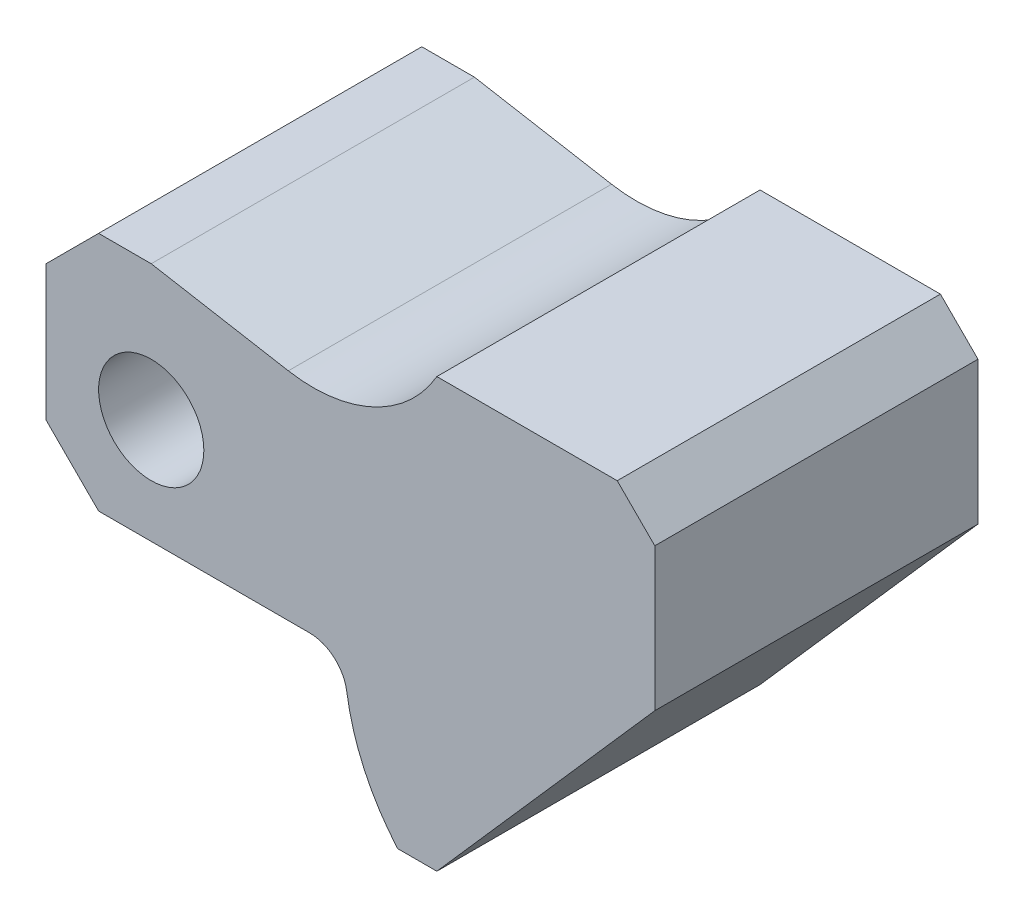
from build123d import *

# Parameters (mm, degrees)
SKETCH1_R           = 7
BOSS_EXTRUDE1_DEPTH = 43


with BuildPart() as part:
    # Sketch1 → Boss-Extrude1 (new body)
    with BuildSketch(Plane.XY):
        with BuildLine():
            Line((0, 7), (0, 25))
            Line((0, 25), (7, 32))
            Line((7, 32), (14, 32))
            Line((14, 32), (32.243084988, 28.783251905))
            ThreePointArc((32.243084988, 28.783251905), (43.574972961, 30.276069151), (52, 38))
            Line((52, 38), (76, 38))
            Line((76, 38), (81, 33))
            Line((81, 33), (81, 14))
            Line((81, 14), (52, -19))
            Line((52, -19), (46.788067397, -19))
            ThreePointArc((46.788067397, -19), (42.3490952, -12.115672061), (40.012264997, -4.264705882))
            ThreePointArc((40.012264997, -4.264705882), (38.331862036, -1.213413768), (35.066626255, 0))
            Line((35.066626255, 0), (7, 0))
            Line((7, 0), (0, 7))
        make_face()
        with Locations((14, 14)):
            Circle(SKETCH1_R, mode=Mode.SUBTRACT)
    extrude(amount=BOSS_EXTRUDE1_DEPTH)


solid = part.part
